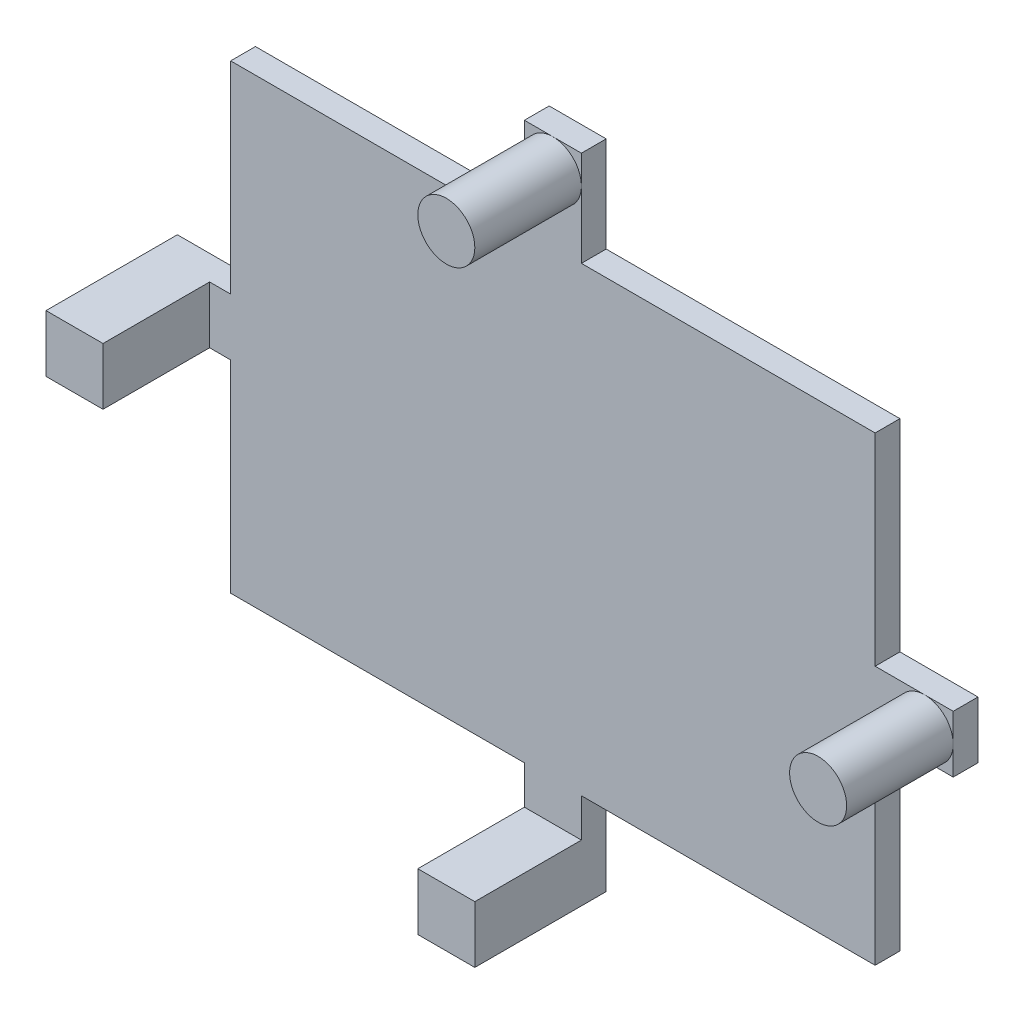
from build123d import *

# Parameters (mm, degrees)
SKETCH1_W             = 130
SKETCH1_H             = 93
BOSS_EXTRUDE1_DEPTH   = 5
SKETCH2_R             = 5.75
BOSS_EXTRUDE2_DEPTH   = 21.5
BOSS_EXTRUDE2_2_DEPTH = 21.5
SKETCH2_W             = 11.5
SKETCH2_H             = 11.5
BOSS_EXTRUDE2_3_DEPTH = 21.5
BOSS_EXTRUDE2_4_DEPTH = 21.5
SKETCH3_W             = 11.5
SKETCH3_H             = 19.25
SKETCH3_W_2           = 15.75
SKETCH3_H_2           = 11.5
BOSS_EXTRUDE3_DEPTH   = 5


with BuildPart() as part:
    # Sketch1 → Boss-Extrude1 (new body)
    with BuildSketch(Plane.XY):
        Rectangle(SKETCH1_W, SKETCH1_H)
    extrude(amount=BOSS_EXTRUDE1_DEPTH)



with BuildPart() as body_2:
    # Sketch2 → Boss-Extrude2 (new body)
    with BuildSketch(Plane.XY.offset(5)):
        with Locations((0, 60)):
            Circle(SKETCH2_R)
    extrude(amount=BOSS_EXTRUDE2_DEPTH)


with BuildPart() as body_3:
    # Sketch2 → Boss-Extrude2 2 (new body)
    with BuildSketch(Plane.XY.offset(5)):
        with Locations((75, 0)):
            Circle(SKETCH2_R)
    extrude(amount=BOSS_EXTRUDE2_2_DEPTH)


with BuildPart() as body_4:
    # Sketch2 → Boss-Extrude2 3 (new body)
    with BuildSketch(Plane.XY.offset(5)):
        with Locations((-75, 0)):
            Rectangle(SKETCH2_W, SKETCH2_H)
    extrude(amount=BOSS_EXTRUDE2_3_DEPTH)


with BuildPart() as body_5:
    # Sketch2 → Boss-Extrude2 4 (new body)
    with BuildSketch(Plane.XY.offset(5)):
        with Locations((0, -60)):
            Rectangle(SKETCH2_W, SKETCH2_H)
    extrude(amount=BOSS_EXTRUDE2_4_DEPTH)


with BuildPart() as part_1:
    add(part.part)

    add(body_2.part)  # Boss-Extrude3 merges body 2

    add(body_3.part)  # Boss-Extrude3 merges body 3

    add(body_4.part)  # Boss-Extrude3 merges body 4

    add(body_5.part)  # Boss-Extrude3 merges body 5
    # Sketch3 → Boss-Extrude3 (add)
    with BuildSketch(Plane(origin=(0, 0, 0), x_dir=(-1, 0, 0), z_dir=(0, 0, -1))):
        with Locations((0, 56.125)):
            Rectangle(SKETCH3_W, SKETCH3_H)
        with Locations((-72.875, 0)):
            Rectangle(SKETCH3_W_2, SKETCH3_H_2)
        with Locations((0, -56.125)):
            Rectangle(SKETCH3_W, SKETCH3_H)
        with Locations((72.875, 0)):
            Rectangle(SKETCH3_W_2, SKETCH3_H_2)
    extrude(amount=-BOSS_EXTRUDE3_DEPTH)


solid = part_1.part
